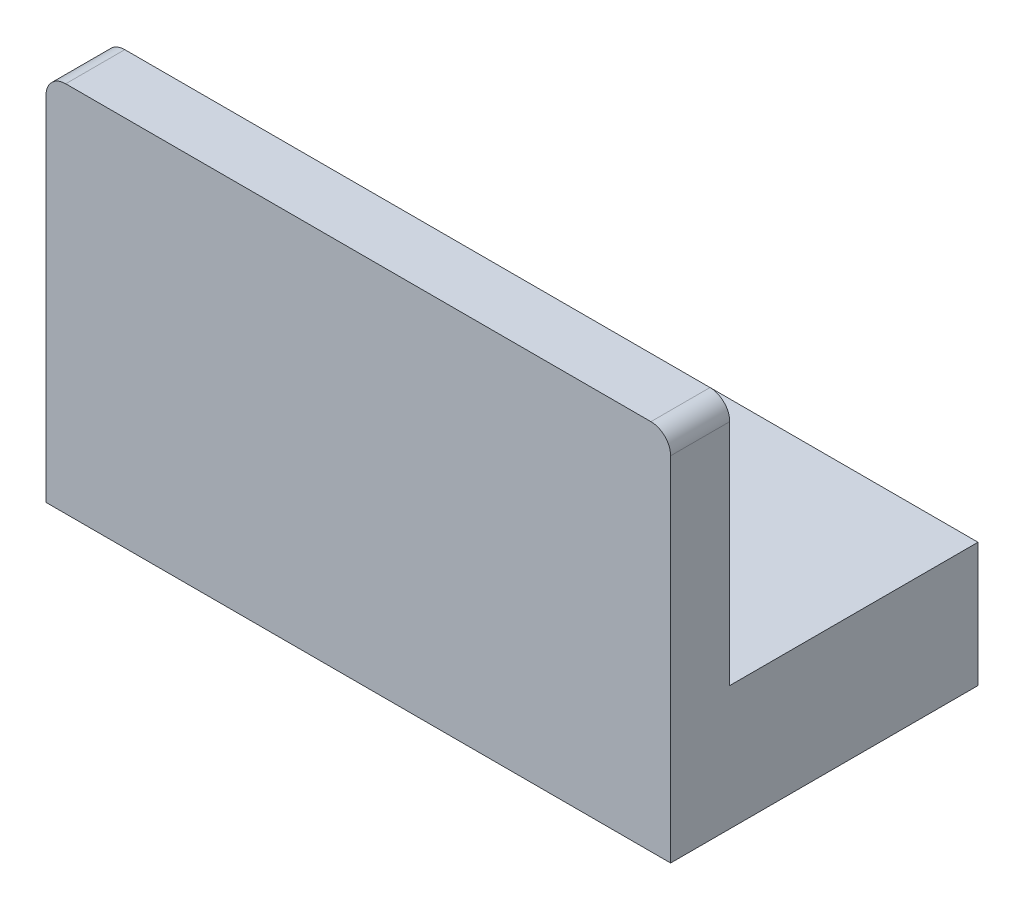
from build123d import *

# Parameters (mm, degrees)
BOSS_EXTRUDE1_DEPTH = 15.85
SHELL1_T            = -1.55
SKETCH2_R           = 1.5
SKETCH2_R_2         = 0.7
BOSS_EXTRUDE2_DEPTH = 1.4
FILLET1_R           = 0.5


with BuildPart() as part:
    # Sketch1 → Boss-Extrude1 (new body)
    with BuildSketch(Plane(origin=(0, 0, 0), x_dir=(0, 0, -1), z_dir=(1, 0, 0))):
        Polygon((0, 0), (7.8, 0), (7.8, 3.15), (1.5, 3.15), (1.5, 9.45), (0, 9.45), align=None)
    extrude(amount=-BOSS_EXTRUDE1_DEPTH)

    # Shell1
    shell1_openings = [part.faces().sort_by_distance(p)[0] for p in [
        (-7.925, 0, -3.9),
    ]]
    offset(amount=SHELL1_T, openings=shell1_openings, kind=Kind.INTERSECTION)

    # Sketch2 → Boss-Extrude2 (add)
    with BuildSketch(Plane.XZ.offset(-1.6)):
        with Locations(Location((-7.925, -3.9, 0), (0, 0, 90))):
            Circle(SKETCH2_R)
        with Locations(Location((-7.925, -3.9, 0), (0, 0, 270))):
            Circle(SKETCH2_R_2, mode=Mode.SUBTRACT)
    extrude(amount=BOSS_EXTRUDE2_DEPTH)

    # Fillet1
    fillet1_edges = [part.edges().sort_by_distance(p)[0] for p in [
        (-15.85, 9.45, -0.75),
        (0, 9.45, -0.75),
    ]]
    fillet(fillet1_edges, radius=FILLET1_R)


solid = part.part
